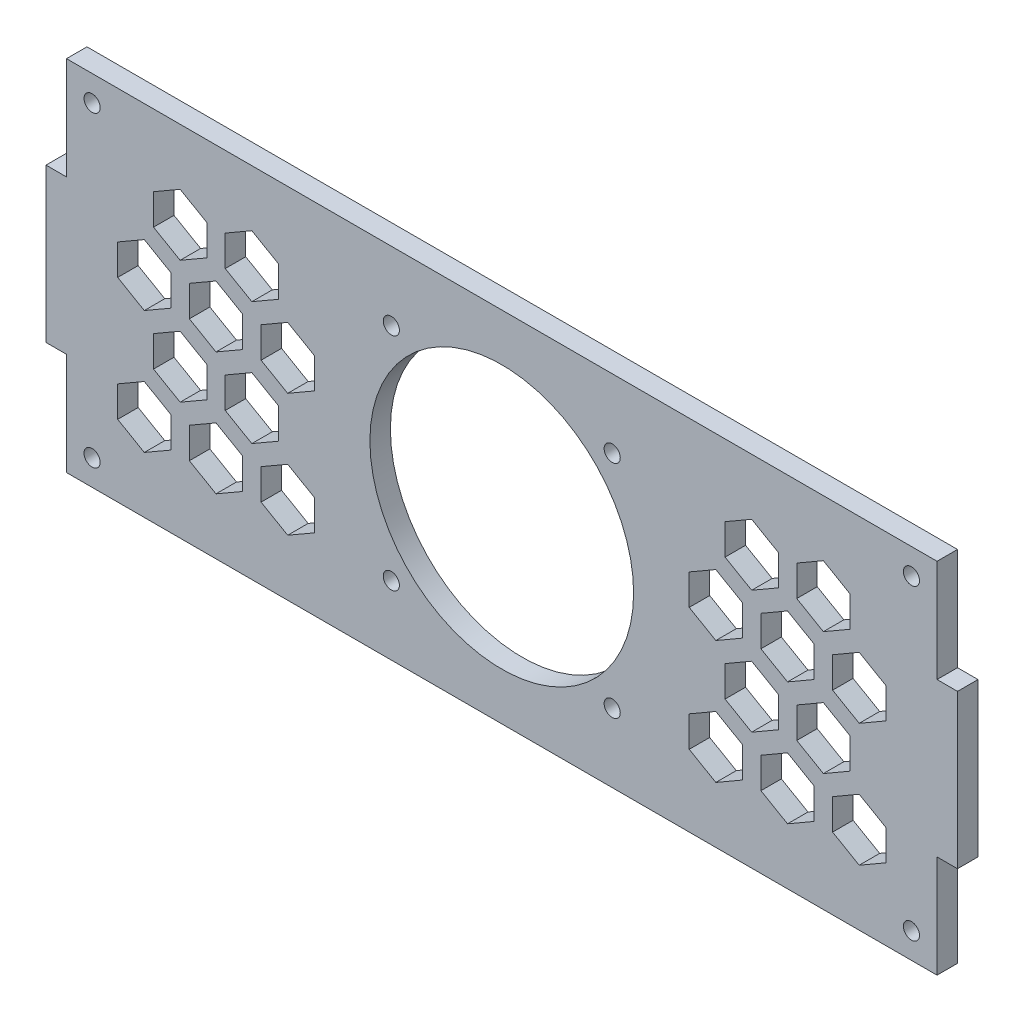
from build123d import *

# Parameters (mm, degrees)
SKETCH_1_W          = 178
SKETCH_1_H          = 70
EXTRUDE_1_DEPTH     = 4
SKETCH_2_R          = 25.75
SKETCH_2_R_2        = 1.575
SKETCH_2_W          = 4
SKETCH_2_H          = 20
CUT_EXTRUDE_1_DEPTH = 192.311264697


with BuildPart() as part:
    # 草图1 → 凸台-拉伸1 (new body)
    with BuildSketch(Plane.XY):
        with Locations((89, -35)):
            Rectangle(SKETCH_1_W, SKETCH_1_H)
    extrude(amount=EXTRUDE_1_DEPTH)

    # 草图2 → 切除-拉伸1 (cut, through all)
    with BuildSketch(Plane.XY.offset(4)):
        with Locations((89, -35)):
            Circle(SKETCH_2_R)
        with Locations((9, -5)):
            Circle(SKETCH_2_R_2)
        with Locations(Location((9, -65, 0), (0, 0, 180))):
            Circle(SKETCH_2_R_2)
        with Locations((169, -65)):
            Circle(SKETCH_2_R_2)
        with Locations(Location((169, -5, 0), (0, 0, 180))):
            Circle(SKETCH_2_R_2)
        with Locations((67.433243174, -13.433243174)):
            Circle(SKETCH_2_R_2)
        with Locations((110.566756826, -13.433243174)):
            Circle(SKETCH_2_R_2)
        with Locations((110.566756826, -56.566756826)):
            Circle(SKETCH_2_R_2)
        with Locations((67.433243174, -56.566756826)):
            Circle(SKETCH_2_R_2)
        with Locations((2, -10)):
            Rectangle(SKETCH_2_W, SKETCH_2_H)
        with Locations((176, -10)):
            Rectangle(SKETCH_2_W, SKETCH_2_H)
        with Locations((176, -60)):
            Rectangle(SKETCH_2_W, SKETCH_2_H)
        with Locations((2, -60)):
            Rectangle(SKETCH_2_W, SKETCH_2_H)
        Polygon((40.196152423, -11), (35, -14), (35, -20), (40.196152423, -23), (45.392304845, -20), (45.392304845, -14), align=None)
        Polygon((26.196152423, -23), (31.392304845, -20), (31.392304845, -14), (26.196152423, -11), (21, -14), (21, -20), align=None)
        Polygon((33.196152423, -35), (38.392304845, -32), (38.392304845, -26), (33.196152423, -23), (28, -26), (28, -32), align=None)
        Polygon((52.392304845, -26), (47.196152423, -23), (42, -26), (42, -32), (47.196152423, -35), (52.392304845, -32), align=None)
        Polygon((24.392304845, -26), (24.392304845, -32), (19.196152423, -35), (14, -32), (14, -26), (19.196152423, -23), align=None)
        Polygon((45.392304845, -38), (45.392304845, -44), (40.196152423, -47), (35, -44), (35, -38), (40.196152423, -35), align=None)
        Polygon((21, -38), (26.196152423, -35), (31.392304845, -38), (31.392304845, -44), (26.196152423, -47), (21, -44), align=None)
        Polygon((14, -56), (19.196152423, -59), (24.392304845, -56), (24.392304845, -50), (19.196152423, -47), (14, -50), align=None)
        Polygon((42, -56), (42, -50), (47.196152423, -47), (52.392304845, -50), (52.392304845, -56), (47.196152423, -59), align=None)
        Polygon((28, -50), (33.196152423, -47), (38.392304845, -50), (38.392304845, -56), (33.196152423, -59), (28, -56), align=None)
        Polygon((144.803847577, -47), (139.607695155, -50), (139.607695155, -56), (144.803847577, -59), (150, -56), (150, -50), align=None)
        Polygon((125.607695155, -56), (130.803847577, -59), (136, -56), (136, -50), (130.803847577, -47), (125.607695155, -50), align=None)
        Polygon((153.607695155, -56), (153.607695155, -50), (158.803847577, -47), (164, -50), (164, -56), (158.803847577, -59), align=None)
        Polygon((137.803847577, -47), (143, -44), (143, -38), (137.803847577, -35), (132.607695155, -38), (132.607695155, -44), align=None)
        Polygon((151.803847577, -35), (146.607695155, -38), (146.607695155, -44), (151.803847577, -47), (157, -44), (157, -38), align=None)
        Polygon((164, -26), (158.803847577, -23), (153.607695155, -26), (153.607695155, -32), (158.803847577, -35), (164, -32), align=None)
        Polygon((136, -26), (136, -32), (130.803847577, -35), (125.607695155, -32), (125.607695155, -26), (130.803847577, -23), align=None)
        Polygon((150, -32), (144.803847577, -35), (139.607695155, -32), (139.607695155, -26), (144.803847577, -23), (150, -26), align=None)
        Polygon((132.607695155, -20), (132.607695155, -14), (137.803847577, -11), (143, -14), (143, -20), (137.803847577, -23), align=None)
        Polygon((157, -20), (151.803847577, -23), (146.607695155, -20), (146.607695155, -14), (151.803847577, -11), (157, -14), align=None)
    extrude(amount=-CUT_EXTRUDE_1_DEPTH, mode=Mode.SUBTRACT)


solid = part.part
